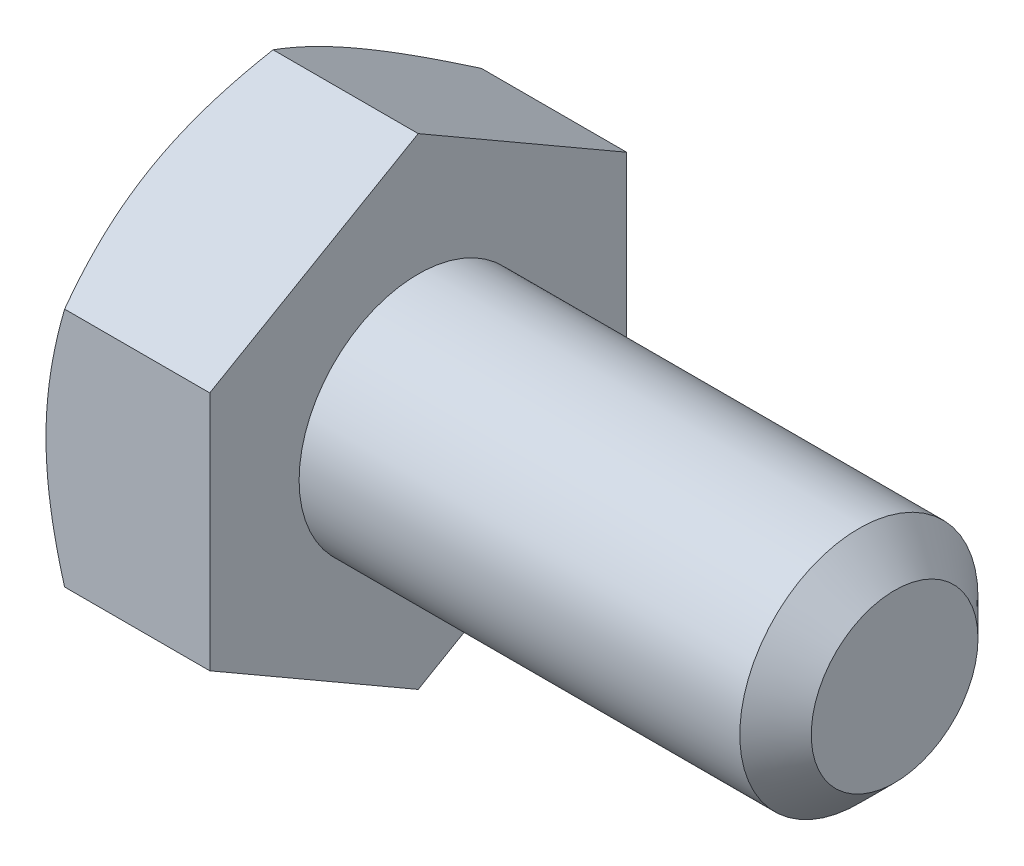
from build123d import *

# Parameters (mm, degrees)
SKETCH5_R           = 3.175
BOSS_EXTRUDE3_DEPTH = 12.7
CHAMFER1_SIZE       = 0.9525
BOSS_EXTRUDE4_DEPTH = 4.365625
SKETCH8_OUTSIDE_W   = 87.414
SKETCH8_OUTSIDE_H   = 89.134
SKETCH8_OUTSIDE_R   = 5.55625
CUT_EXTRUDE3_DEPTH  = 20.059643826
CUT_EXTRUDE3_DRAFT  = -60


with BuildPart() as part:
    # Sketch5 → Boss-Extrude3 (new body)
    with BuildSketch(Plane(origin=(8.5328125, 0, 0), x_dir=(0, 0, -1), z_dir=(1, 0, 0))):
        Circle(SKETCH5_R)
    extrude(amount=-BOSS_EXTRUDE3_DEPTH)

    # Chamfer1
    chamfer1_edges = [part.edges().sort_by_distance(p)[0] for p in [
        (8.5328125, 0, 3.175),
    ]]
    chamfer(chamfer1_edges, length=CHAMFER1_SIZE)

    # Sketch6 → Boss-Extrude4 (add)
    with BuildSketch(Plane.ZY.offset(4.1671875)):
        Polygon((5.55625, 3.207902433), (0, 6.415804866), (-5.55625, 3.207902433), (-5.55625, -3.207902433), (0, -6.415804866), (5.55625, -3.207902433), align=None)
    extrude(amount=BOSS_EXTRUDE4_DEPTH)


with BuildPart() as cut_extrude3_tool:
    # Sketch8 outside → Cut-Extrude3 (with draft: the straight prism first)
    with BuildSketch(Plane.ZY.offset(8.5328125)):
        Rectangle(SKETCH8_OUTSIDE_W, SKETCH8_OUTSIDE_H)
        Circle(SKETCH8_OUTSIDE_R, mode=Mode.SUBTRACT)
    extrude(amount=-CUT_EXTRUDE3_DEPTH)
    # Cut-Extrude3: the draft: its side faces are tilted about the plane it starts from
    cut_extrude3_sides = [cut_extrude3_tool.faces().sort_by_distance(p)[0] for p in [
        (1.497009413, -44.567, 0),
        (1.497009413, 0, 43.707),
        (1.497009413, 44.567, 0),
        (1.497009413, 0, -43.707),
        (1.497009413, 0, -5.55625),
    ]]
    draft(cut_extrude3_sides, Plane.ZY.offset(8.5328125), CUT_EXTRUDE3_DRAFT)


with BuildPart() as part_1:
    add(part.part)

    # Cut-Extrude3: cut by cut_extrude3_tool
    add(cut_extrude3_tool.part, mode=Mode.SUBTRACT)


solid = part_1.part
